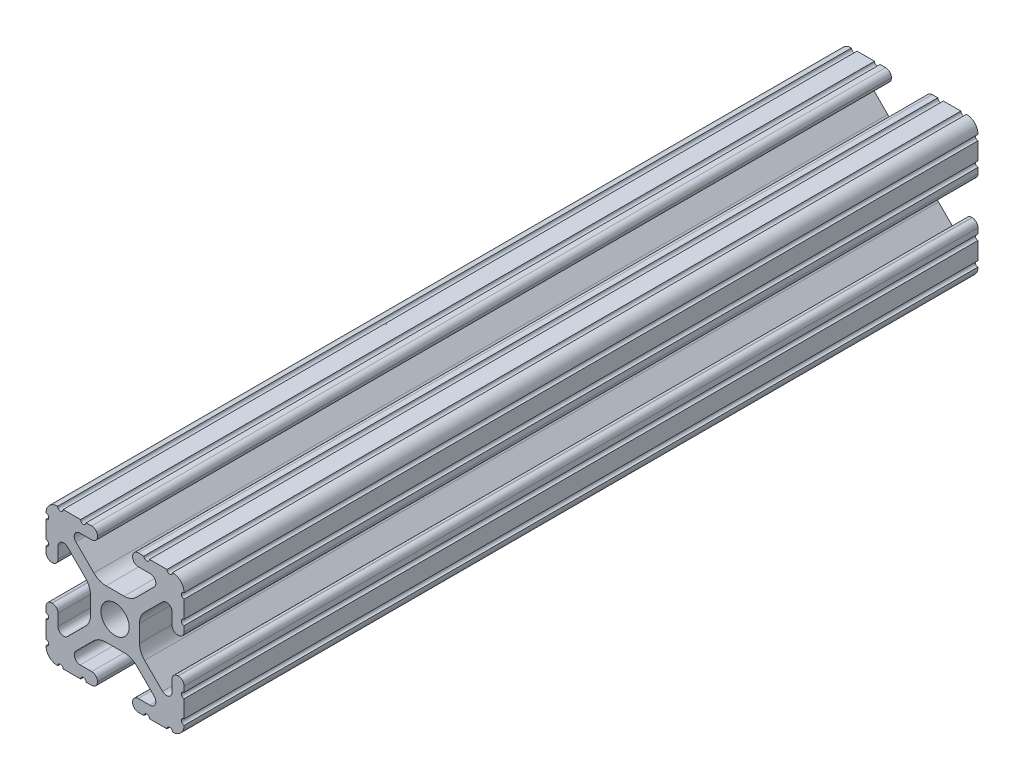
from build123d import *

# Parameters (mm, degrees)
SKETCH1_R      = 2.6035
EXTRUDE1_DEPTH = 146.05


with BuildPart() as part:
    # Sketch1 → Extrude1 (new body)
    with BuildSketch(Plane.XY):
        with BuildLine():
            Line((-7.207036008, 8.724370562), (-3.898272566, 5.423169045))
            ThreePointArc((-3.898272566, 5.423169045), (-2.869120213, 4.736787962), (-1.655778399, 4.4958))
            Line((-1.655778399, 4.4958), (1.655778399, 4.4958))
            ThreePointArc((1.655778399, 4.4958), (2.869120213, 4.736787962), (3.898272566, 5.423169045))
            Line((3.898272566, 5.423169045), (7.207036008, 8.724370562))
            ThreePointArc((7.207036008, 8.724370562), (7.432222385, 9.85140422), (6.476788598, 10.4902))
            Line((6.476788598, 10.4902), (4.287512407, 10.4902))
            ThreePointArc((4.287512407, 10.4902), (3.54574862, 10.79744862), (3.2385, 11.539212407))
            Line((3.2385, 11.539212407), (3.2385, 11.650987593))
            ThreePointArc((3.2385, 11.650987593), (3.54574862, 12.39275138), (4.287512407, 12.7))
            Line((4.287512407, 12.7), (5.317126718, 12.7))
            ThreePointArc((5.317126718, 12.7), (5.825126718, 12.192), (6.333126718, 12.7))
            Line((6.333126718, 12.7), (9.550443118, 12.7))
            ThreePointArc((9.550443118, 12.7), (10.058366869, 12.192000006), (10.566443095, 12.699847501))
            ThreePointArc((10.566443095, 12.699847501), (12.082537762, 12.08250727), (12.699846982, 10.566399977))
            ThreePointArc((12.699846982, 10.566399977), (12.192000006, 10.058323491), (12.7, 9.5504))
            Line((12.7, 9.5504), (12.7, 6.3330836))
            ThreePointArc((12.7, 6.3330836), (12.192, 5.8250836), (12.7, 5.3170836))
            Line((12.7, 5.3170836), (12.7, 4.287469289))
            ThreePointArc((12.7, 4.287469289), (12.39275138, 3.545705502), (11.650987593, 3.238456882))
            Line((11.650987593, 3.238456882), (11.539212407, 3.238456882))
            ThreePointArc((11.539212407, 3.238456882), (10.79744862, 3.545705502), (10.4902, 4.287469289))
            Line((10.4902, 4.287469289), (10.4902, 6.402089023))
            ThreePointArc((10.4902, 6.402089023), (9.856505071, 7.351067942), (8.737131347, 7.129408934))
            Line((8.737131347, 7.129408934), (5.441005833, 3.840816462))
            ThreePointArc((5.441005833, 3.840816462), (4.750877967, 2.809883091), (4.5085, 1.593185507))
            Line((4.5085, 1.593185507), (4.5085, -1.593185507))
            ThreePointArc((4.5085, -1.593185507), (4.750877967, -2.809883091), (5.441005833, -3.840816462))
            Line((5.441005833, -3.840816462), (8.737131347, -7.129408934))
            ThreePointArc((8.737131347, -7.129408934), (9.856505071, -7.351067942), (10.4902, -6.402089023))
            Line((10.4902, -6.402089023), (10.4902, -4.287469289))
            ThreePointArc((10.4902, -4.287469289), (10.79744862, -3.545705502), (11.539212407, -3.238456882))
            Line((11.539212407, -3.238456882), (11.650987593, -3.238456882))
            ThreePointArc((11.650987593, -3.238456882), (12.39275138, -3.545705502), (12.7, -4.287469289))
            Line((12.7, -4.287469289), (12.7, -5.3170836))
            ThreePointArc((12.7, -5.3170836), (12.192, -5.8250836), (12.7, -6.3330836))
            Line((12.7, -6.3330836), (12.7, -9.5504))
            ThreePointArc((12.7, -9.5504), (12.192000006, -10.058323491), (12.699846982, -10.566399977))
            ThreePointArc((12.699846982, -10.566399977), (12.082537762, -12.08250727), (10.566443095, -12.699847501))
            ThreePointArc((10.566443095, -12.699847501), (10.058366869, -12.192000006), (9.550443118, -12.7))
            Line((9.550443118, -12.7), (6.333126718, -12.7))
            ThreePointArc((6.333126718, -12.7), (5.825126718, -12.192), (5.317126718, -12.7))
            Line((5.317126718, -12.7), (4.287512407, -12.7))
            ThreePointArc((4.287512407, -12.7), (3.54574862, -12.39275138), (3.2385, -11.650987593))
            Line((3.2385, -11.650987593), (3.2385, -11.539212407))
            ThreePointArc((3.2385, -11.539212407), (3.54574862, -10.79744862), (4.287512407, -10.4902))
            Line((4.287512407, -10.4902), (6.416408329, -10.4902))
            ThreePointArc((6.416408329, -10.4902), (7.41473083, -9.822813117), (7.179650497, -8.645192506))
            Line((7.179650497, -8.645192506), (3.952270251, -5.423690499))
            ThreePointArc((3.952270251, -5.423690499), (2.922936451, -4.736929036), (1.709253557, -4.4958))
            Line((1.709253557, -4.4958), (-1.709253557, -4.4958))
            ThreePointArc((-1.709253557, -4.4958), (-2.922936451, -4.736929036), (-3.952270251, -5.423690499))
            Line((-3.952270251, -5.423690499), (-7.179650497, -8.645192506))
            ThreePointArc((-7.179650497, -8.645192506), (-7.41473083, -9.822813117), (-6.416408329, -10.4902))
            Line((-6.416408329, -10.4902), (-4.287512407, -10.4902))
            ThreePointArc((-4.287512407, -10.4902), (-3.54574862, -10.79744862), (-3.2385, -11.539212407))
            Line((-3.2385, -11.539212407), (-3.2385, -11.650987593))
            ThreePointArc((-3.2385, -11.650987593), (-3.54574862, -12.39275138), (-4.287512407, -12.7))
            Line((-4.287512407, -12.7), (-5.317126718, -12.7))
            ThreePointArc((-5.317126718, -12.7), (-5.825126718, -12.192), (-6.333126718, -12.7))
            Line((-6.333126718, -12.7), (-9.550443118, -12.7))
            ThreePointArc((-9.550443118, -12.7), (-10.058366869, -12.192000006), (-10.566443095, -12.699847501))
            ThreePointArc((-10.566443095, -12.699847501), (-12.082537762, -12.08250727), (-12.699846982, -10.566399977))
            ThreePointArc((-12.699846982, -10.566399977), (-12.192000006, -10.058323491), (-12.7, -9.5504))
            Line((-12.7, -9.5504), (-12.7, -6.3330836))
            ThreePointArc((-12.7, -6.3330836), (-12.192, -5.8250836), (-12.7, -5.3170836))
            Line((-12.7, -5.3170836), (-12.7, -4.287469289))
            ThreePointArc((-12.7, -4.287469289), (-12.39275138, -3.545705502), (-11.650987593, -3.238456882))
            Line((-11.650987593, -3.238456882), (-11.539212407, -3.238456882))
            ThreePointArc((-11.539212407, -3.238456882), (-10.79744862, -3.545705502), (-10.4902, -4.287469289))
            Line((-10.4902, -4.287469289), (-10.4902, -6.402089023))
            ThreePointArc((-10.4902, -6.402089023), (-9.856505071, -7.351067942), (-8.737131347, -7.129408934))
            Line((-8.737131347, -7.129408934), (-5.441005833, -3.840816462))
            ThreePointArc((-5.441005833, -3.840816462), (-4.750877967, -2.809883091), (-4.5085, -1.593185507))
            Line((-4.5085, -1.593185507), (-4.5085, 1.593185507))
            ThreePointArc((-4.5085, 1.593185507), (-4.750877967, 2.809883091), (-5.441005833, 3.840816462))
            Line((-5.441005833, 3.840816462), (-8.737131347, 7.129408934))
            ThreePointArc((-8.737131347, 7.129408934), (-9.856505071, 7.351067942), (-10.4902, 6.402089023))
            Line((-10.4902, 6.402089023), (-10.4902, 4.287469289))
            ThreePointArc((-10.4902, 4.287469289), (-10.79744862, 3.545705502), (-11.539212407, 3.238456882))
            Line((-11.539212407, 3.238456882), (-11.650987593, 3.238456882))
            ThreePointArc((-11.650987593, 3.238456882), (-12.39275138, 3.545705502), (-12.7, 4.287469289))
            Line((-12.7, 4.287469289), (-12.7, 5.3170836))
            ThreePointArc((-12.7, 5.3170836), (-12.192, 5.8250836), (-12.7, 6.3330836))
            Line((-12.7, 6.3330836), (-12.7, 9.5504))
            ThreePointArc((-12.7, 9.5504), (-12.192000006, 10.058323491), (-12.699846982, 10.566399977))
            ThreePointArc((-12.699846982, 10.566399977), (-12.082537762, 12.08250727), (-10.566443095, 12.699847501))
            ThreePointArc((-10.566443095, 12.699847501), (-10.058366869, 12.192000006), (-9.550443118, 12.7))
            Line((-9.550443118, 12.7), (-6.333126718, 12.7))
            ThreePointArc((-6.333126718, 12.7), (-5.825126718, 12.192), (-5.317126718, 12.7))
            Line((-5.317126718, 12.7), (-4.287512407, 12.7))
            ThreePointArc((-4.287512407, 12.7), (-3.54574862, 12.39275138), (-3.2385, 11.650987593))
            Line((-3.2385, 11.650987593), (-3.2385, 11.539212407))
            ThreePointArc((-3.2385, 11.539212407), (-3.54574862, 10.79744862), (-4.287512407, 10.4902))
            Line((-4.287512407, 10.4902), (-6.476788598, 10.4902))
            ThreePointArc((-6.476788598, 10.4902), (-7.432222385, 9.85140422), (-7.207036008, 8.724370562))
        make_face()
        Circle(SKETCH1_R, mode=Mode.SUBTRACT)
    extrude(amount=-EXTRUDE1_DEPTH)


solid = part.part
